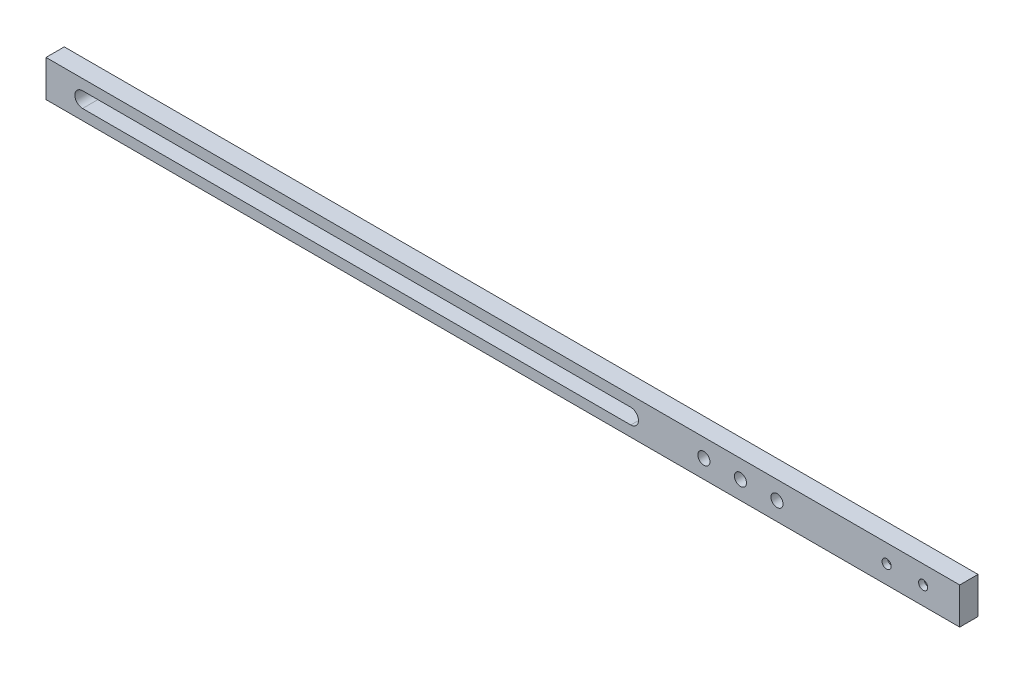
from build123d import *

# Parameters (mm, degrees)
SKETCH_1_W          = 250
SKETCH_1_H          = 10
EXTRUDE_1_DEPTH     = 5
CUT_EXTRUDE_1_DEPTH = 5
SKETCH_3_R          = 1.25
CUT_EXTRUDE_2_DEPTH = 5
SKETCH_4_R          = 2.8
CUT_EXTRUDE_3_DEPTH = 3.5
SKETCH_5_R          = 1.65
CUT_EXTRUDE_4_DEPTH = 10


with BuildPart() as part:
    # Эскиз1 → Бобышка-Вытянуть1 (new body)
    with BuildSketch(Plane.XY):
        Rectangle(SKETCH_1_W, SKETCH_1_H)
    extrude(amount=EXTRUDE_1_DEPTH)

    # Эскиз2 → Вырез-Вытянуть1 (cut)
    with BuildSketch(Plane(origin=(0, 0, 0), x_dir=(-1, 0, 0), z_dir=(0, 0, -1))):
        with BuildLine():
            Line((-35, 2.1), (115, 2.1))
            ThreePointArc((115, 2.1), (117.1, 0), (115, -2.1))
            Line((115, -2.1), (-35, -2.1))
            ThreePointArc((-35, -2.1), (-37.1, 0), (-35, 2.1))
        make_face()
    extrude(amount=-CUT_EXTRUDE_1_DEPTH, mode=Mode.SUBTRACT)

    # Эскиз3 → Вырез-Вытянуть2 (cut)
    with BuildSketch(Plane(origin=(0, 0, 0), x_dir=(-1, 0, 0), z_dir=(0, 0, -1))):
        with Locations((-115, 0)):
            Circle(SKETCH_3_R)
        with Locations((-105, 0)):
            Circle(SKETCH_3_R)
    extrude(amount=-CUT_EXTRUDE_2_DEPTH, mode=Mode.SUBTRACT)

    # Эскиз4 → Вырез-Вытянуть3 (cut)
    with BuildSketch(Plane(origin=(0, 0, 0), x_dir=(-1, 0, 0), z_dir=(0, 0, -1))):
        with Locations((-115, 0)):
            Circle(SKETCH_4_R)
        with Locations((-105, 0)):
            Circle(SKETCH_4_R)
    extrude(amount=-CUT_EXTRUDE_3_DEPTH, mode=Mode.SUBTRACT)

    # Эскиз5 → Вырез-Вытянуть4 (cut)
    with BuildSketch(Plane(origin=(0, 0, 0), x_dir=(-1, 0, 0), z_dir=(0, 0, -1))):
        with Locations((-75, 0)):
            Circle(SKETCH_5_R)
        with Locations((-65, 0)):
            Circle(SKETCH_5_R)
        with Locations((-55, 0)):
            Circle(SKETCH_5_R)
    extrude(amount=-CUT_EXTRUDE_4_DEPTH, mode=Mode.SUBTRACT)


solid = part.part
